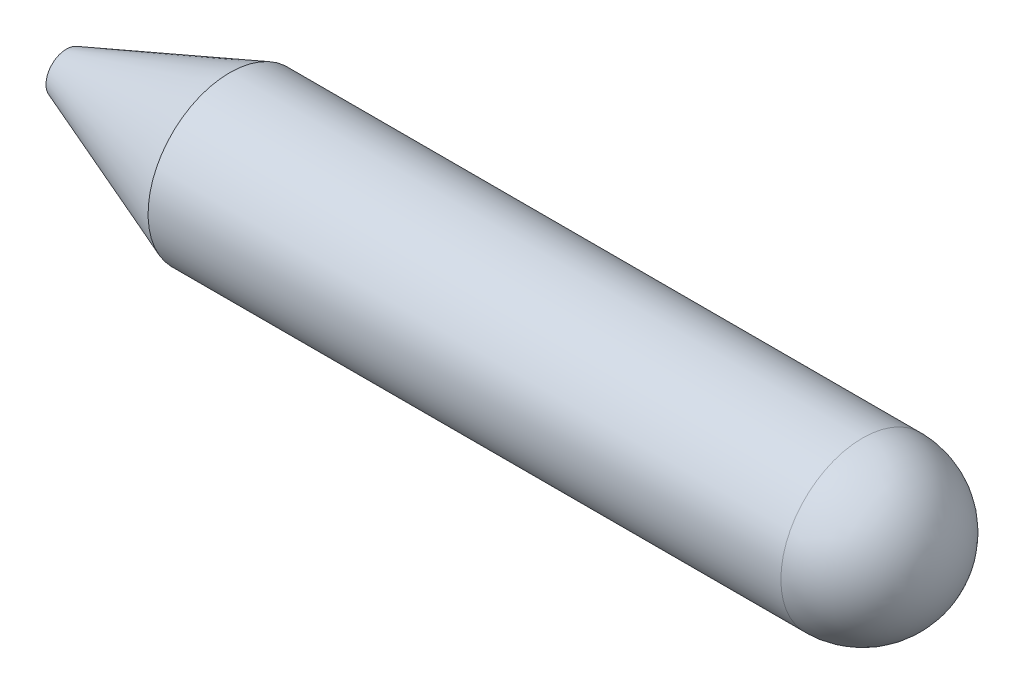
from build123d import *


with BuildPart() as part:
    # Sketch2 → Revolve1 (revolve)
    with BuildSketch(Plane.XY):
        with BuildLine():
            Line((-21.5, 0), (-21.5, 0.5))
            Line((-21.5, 0.5), (-17.5, 2))
            Line((-17.5, 2), (-2, 2))
            ThreePointArc((-2, 2), (-0.585786438, 1.414213562), (0, 0))
            Line((0, 0), (-21.5, 0))
        make_face()
    revolve(axis=Axis((0, 0, 0), (-1, 0, 0)))


solid = part.part
